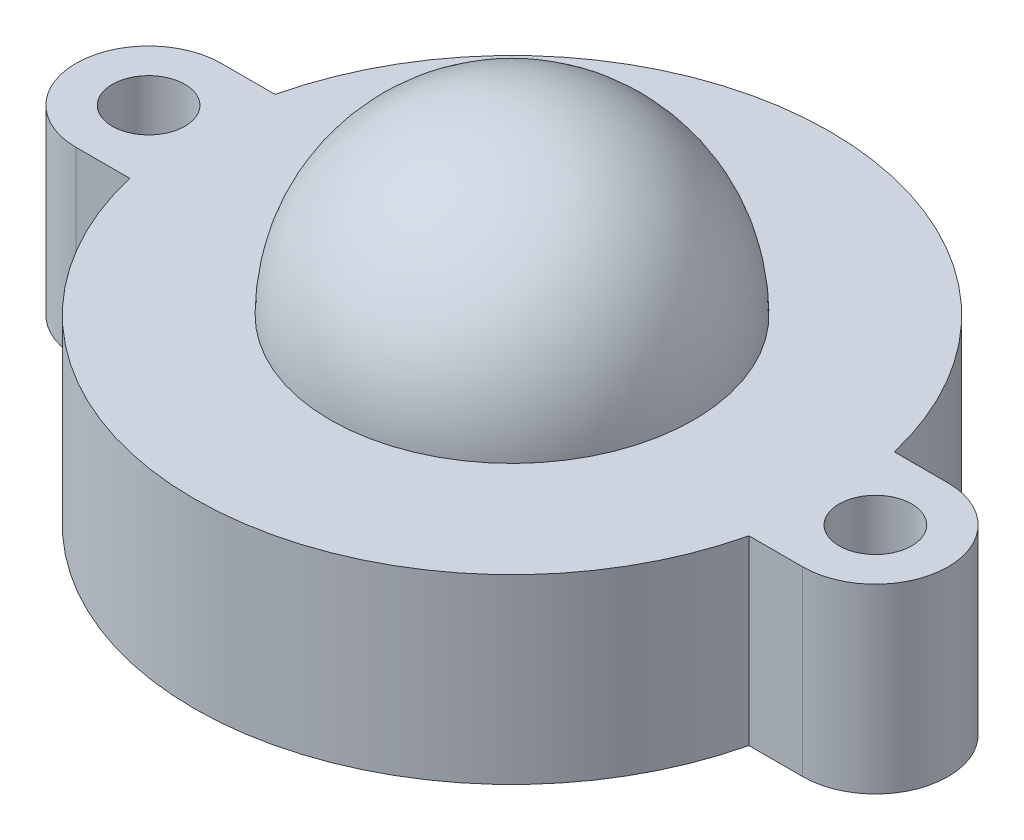
from build123d import *

# Parameters (mm, degrees)
SKETCH1_R           = 17.5
SKETCH1_R_2         = 2
BOSS_EXTRUDE1_DEPTH = 10
REVOLVE1_ANGLE      = 180


with BuildPart() as part:
    # Sketch1 → Boss-Extrude1 (new body)
    # profile 1 of 2: a face of its own
    with BuildSketch(Plane(origin=(0, 0, 0), x_dir=(1, 0, 0), z_dir=(0, 1, 0))):
        Circle(SKETCH1_R)
    # profile 2 of 2: a face of its own
    with BuildSketch(Plane(origin=(0, 0, 0), x_dir=(1, 0, 0), z_dir=(0, 1, 0))):
        with BuildLine():
            Line((-20, -4), (20, -4))
            ThreePointArc((20, -4), (24, 0), (20, 4))
            Line((20, 4), (-20, 4))
            ThreePointArc((-20, 4), (-24, 0), (-20, -4))
        make_face()
        with Locations(Location((-20, 0, 0), (0, 0, 270))):
            Circle(SKETCH1_R_2, mode=Mode.SUBTRACT)
        with Locations(Location((20, 0, 0), (0, 0, 270))):
            Circle(SKETCH1_R_2, mode=Mode.SUBTRACT)
    extrude(amount=BOSS_EXTRUDE1_DEPTH)

    # Sketch2 → Revolve1 (revolve)
    with BuildSketch(Plane(origin=(0, 10, 0), x_dir=(1, 0, 0), z_dir=(0, 1, 0))):
        with BuildLine():
            Line((0, 10), (0, -10))
            ThreePointArc((0, -10), (-10, 0), (0, 10))
        make_face()
    revolve(axis=Axis((0, 10, -10), (0, 0, -1)), revolution_arc=REVOLVE1_ANGLE)


solid = part.part
